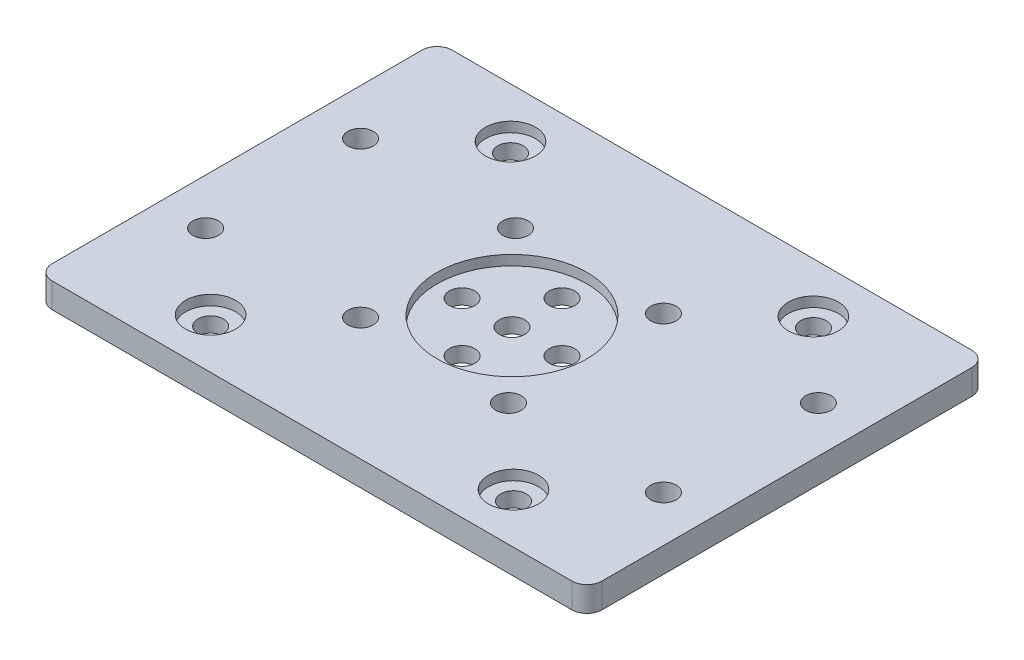
from build123d import *

# Parameters (mm, degrees)
SKETCH1_R           = 2.55
BOSS_EXTRUDE1_DEPTH = 5
SKETCH_1_R          = 5
SKETCH_1_R_2        = 15
CUT_EXTRUDE_1_DEPTH = 2


with BuildPart() as part:
    # Sketch1 → Boss-Extrude1 (new body)
    with BuildSketch(Plane(origin=(0, 0, 0), x_dir=(1, 0, 0), z_dir=(0, 1, 0))):
        with BuildLine():
            Line((52, -40), (-52, -40))
            ThreePointArc((-52, -40), (-54.121320344, -39.121320344), (-55, -37))
            Line((-55, -37), (-55, 37))
            ThreePointArc((-55, 37), (-54.121320344, 39.121320344), (-52, 40))
            Line((-52, 40), (52, 40))
            ThreePointArc((52, 40), (54.121320344, 39.121320344), (55, 37))
            Line((55, 37), (55, -37))
            ThreePointArc((55, -37), (54.121320344, -39.121320344), (52, -40))
        make_face()
        with Locations(Location((-30.3, 30, 0), (0, 0, 270))):
            Circle(SKETCH1_R, mode=Mode.SUBTRACT)
        with Locations(Location((0, 10, 0), (0, 0, 270))):
            Circle(SKETCH1_R, mode=Mode.SUBTRACT)
        with Locations(Location((0, 0, 0), (0, 0, 270))):
            Circle(SKETCH1_R, mode=Mode.SUBTRACT)
        with Locations(Location((10, 0, 0), (0, 0, 270))):
            Circle(SKETCH1_R, mode=Mode.SUBTRACT)
        with Locations(Location((-10, 0, 0), (0, 0, 90))):
            Circle(SKETCH1_R, mode=Mode.SUBTRACT)
        with Locations(Location((-45.8, 15.5, 0), (0, 0, 270))):
            Circle(SKETCH1_R, mode=Mode.SUBTRACT)
        with Locations(Location((30.3, 30, 0), (0, 0, 270))):
            Circle(SKETCH1_R, mode=Mode.SUBTRACT)
        with Locations(Location((0, -10, 0), (0, 0, 90))):
            Circle(SKETCH1_R, mode=Mode.SUBTRACT)
        with Locations(Location((-14.8, 15.5, 0), (0, 0, 270))):
            Circle(SKETCH1_R, mode=Mode.SUBTRACT)
        with Locations(Location((14.8, 15.5, 0), (0, 0, 90))):
            Circle(SKETCH1_R, mode=Mode.SUBTRACT)
        with Locations(Location((45.8, 15.5, 0), (0, 0, 90))):
            Circle(SKETCH1_R, mode=Mode.SUBTRACT)
        with Locations(Location((30.3, -30, 0), (0, 0, 90))):
            Circle(SKETCH1_R, mode=Mode.SUBTRACT)
        with Locations(Location((45.8, -15.5, 0), (0, 0, 270))):
            Circle(SKETCH1_R, mode=Mode.SUBTRACT)
        with Locations(Location((14.8, -15.5, 0), (0, 0, 270))):
            Circle(SKETCH1_R, mode=Mode.SUBTRACT)
        with Locations(Location((-14.8, -15.5, 0), (0, 0, 90))):
            Circle(SKETCH1_R, mode=Mode.SUBTRACT)
        with Locations(Location((-45.8, -15.5, 0), (0, 0, 90))):
            Circle(SKETCH1_R, mode=Mode.SUBTRACT)
        with Locations(Location((-30.3, -30, 0), (0, 0, 90))):
            Circle(SKETCH1_R, mode=Mode.SUBTRACT)
    extrude(amount=BOSS_EXTRUDE1_DEPTH)

    # 草圖1 → 除料-伸長1 (cut)
    with BuildSketch(Plane(origin=(0, 5, 0), x_dir=(1, 0, 0), z_dir=(0, 1, 0))):
        with Locations(Location((-30.3, -30, 0), (0, 0, 270))):
            Circle(SKETCH_1_R)
        with Locations(Location((-30.3, 30, 0), (0, 0, 270))):
            Circle(SKETCH_1_R)
        with Locations(Location((30.3, -30, 0), (0, 0, 270))):
            Circle(SKETCH_1_R)
        with Locations(Location((30.3, 30, 0), (0, 0, 270))):
            Circle(SKETCH_1_R)
        with Locations(Location((0, 0, 0), (0, 0, 270))):
            Circle(SKETCH_1_R_2)
    extrude(amount=-CUT_EXTRUDE_1_DEPTH, mode=Mode.SUBTRACT)


solid = part.part
